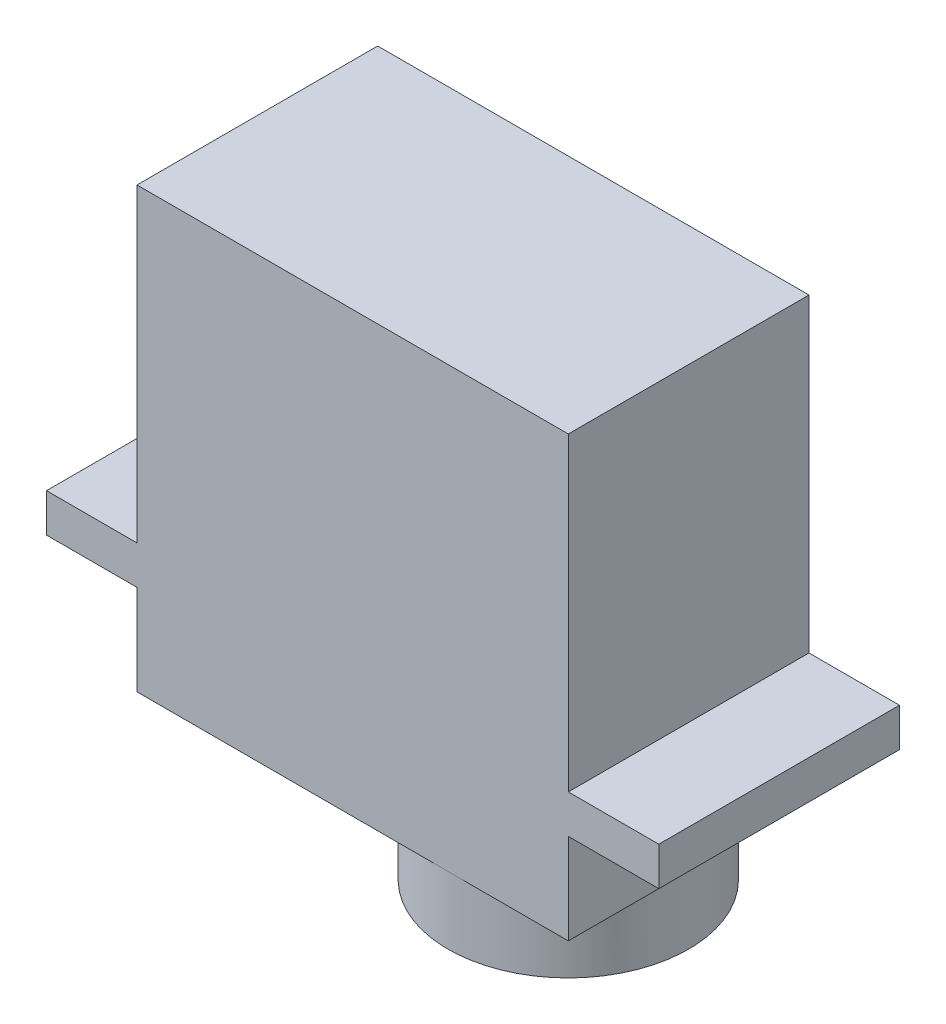
from build123d import *

# Parameters (mm, degrees)
SKETCH1_W           = 22.4
SKETCH1_H           = 12.5
BOSS_EXTRUDE1_DEPTH = 22.8
SKETCH2_W           = 12.5
SKETCH2_H           = 2
BOSS_EXTRUDE2_DEPTH = 4.7
SKETCH3_W           = 12.5
SKETCH3_H           = 2
BOSS_EXTRUDE3_DEPTH = 4.7
BOSS_EXTRUDE5_DEPTH = 3.5
SKETCH5_R           = 2.5
CUT_EXTRUDE1_DEPTH  = 5


with BuildPart() as part:
    # Sketch1 → Boss-Extrude1 (new body)
    with BuildSketch(Plane(origin=(0, 0, 0), x_dir=(1, 0, 0), z_dir=(0, 1, 0))):
        Rectangle(SKETCH1_W, SKETCH1_H)
    extrude(amount=BOSS_EXTRUDE1_DEPTH)

    # Sketch2 → Boss-Extrude2 (add)
    with BuildSketch(Plane(origin=(11.2, 0, 0), x_dir=(0, 0, -1), z_dir=(1, 0, 0))):
        with Locations((0, 5.7)):
            Rectangle(SKETCH2_W, SKETCH2_H)
    extrude(amount=BOSS_EXTRUDE2_DEPTH)

    # Sketch3 → Boss-Extrude3 (add)
    with BuildSketch(Plane.ZY.offset(11.2)):
        with Locations((0, 5.7)):
            Rectangle(SKETCH3_W, SKETCH3_H)
    extrude(amount=BOSS_EXTRUDE3_DEPTH)

    # Sketch4 → Boss-Extrude5 (add)
    with BuildSketch(Plane.XZ):
        with BuildLine():
            ThreePointArc((-0.842105263, -2.348194332), (11.2, 0), (-0.842105263, 2.348194332))
            ThreePointArc((-0.842105263, 2.348194332), (-4.2, 0), (-0.842105263, -2.348194332))
        make_face()
    extrude(amount=BOSS_EXTRUDE5_DEPTH)

    # Sketch5 → Cut-Extrude1 (cut)
    with BuildSketch(Plane.XZ.offset(3.5)):
        with Locations(Location((4.95, 0, 0), (0, 0, 270))):
            Circle(SKETCH5_R)
    extrude(amount=-CUT_EXTRUDE1_DEPTH, mode=Mode.SUBTRACT)


solid = part.part
